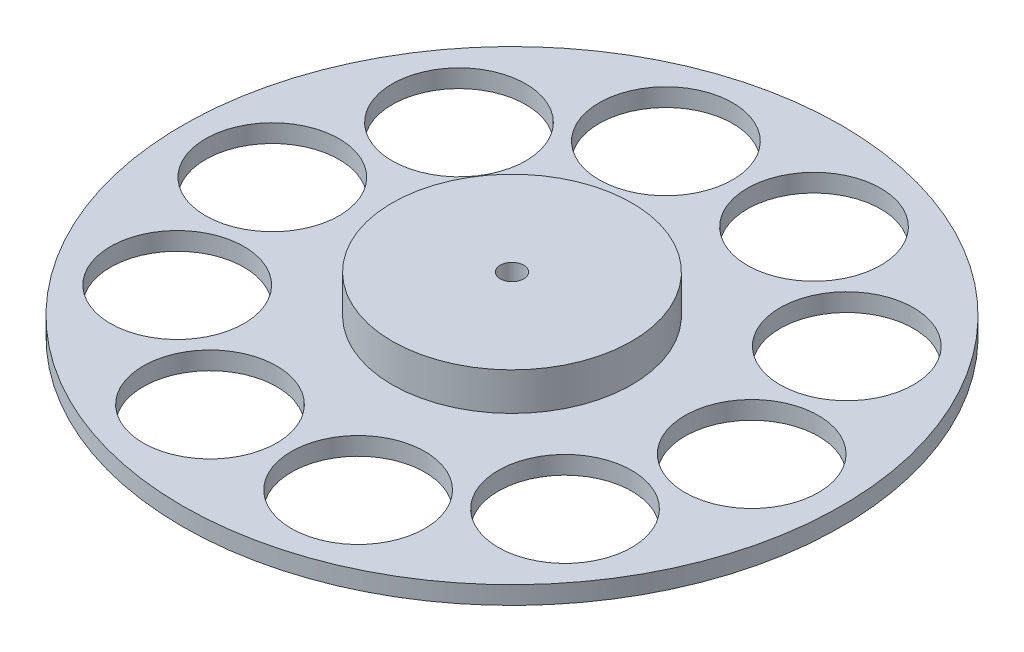
from build123d import *

# Parameters (mm, degrees)
SKETCH1_R                      = 69.85
BOSS_EXTRUDE1_DEPTH            = 3.81
SKETCH4_R                      = 25.4
BOSS_EXTRUDE5_DEPTH            = 7.99999997
SKETCH25_R                     = 11.43
CUT_EXTRUDE4_DEPTH             = 3.99999997
SKETCH5_R                      = 6
BOSS_EXTRUDE6_DEPTH            = 0.508
SKETCH26_R                     = 3.95
BOSS_EXTRUDE7_DEPTH            = 5
CUT_EXTRUDE1_DEPTH             = 100.486285986
CUT_EXTRUDE1_DEPTH_BACK        = 100.486285986
SKETCH6_R                      = 2.5
TAP_DRILL_FOR_M1_2X0_25_TAP1_D = 28.3


with BuildPart() as part:
    # Sketch1 → Boss-Extrude1 (new body)
    with BuildSketch(Plane(origin=(0, 0, 0), x_dir=(1, 0, 0), z_dir=(0, 1, 0))):
        Circle(SKETCH1_R)
    extrude(amount=BOSS_EXTRUDE1_DEPTH)

    # Sketch4 → Boss-Extrude5 (add)
    with BuildSketch(Plane(origin=(0, 3.81, 0), x_dir=(1, 0, 0), z_dir=(0, 1, 0))):
        Circle(SKETCH4_R)
    extrude(amount=BOSS_EXTRUDE5_DEPTH)

    # Sketch25 → Cut-Extrude4 (cut)
    with BuildSketch(Plane.XZ):
        Circle(SKETCH25_R)
    extrude(amount=-CUT_EXTRUDE4_DEPTH, mode=Mode.SUBTRACT)

    # Sketch5 → Boss-Extrude6 (add)
    with BuildSketch(Plane(origin=(0, 3.99999997, 0), x_dir=(1, 0, 0), z_dir=(0, 1, 0))):
        Circle(SKETCH5_R)
    extrude(amount=-BOSS_EXTRUDE6_DEPTH)

    # Sketch26 → Boss-Extrude7 (add)
    with BuildSketch(Plane.XZ.offset(-3.49199997)):
        Circle(SKETCH26_R)
    extrude(amount=BOSS_EXTRUDE7_DEPTH)

    # Sketch6 → Cut-Extrude1 (cut, two sides: drawn at the far end of the back side and taken through both)
    with BuildSketch(Plane.XZ.offset(-CUT_EXTRUDE1_DEPTH_BACK)):
        Circle(SKETCH6_R)
    extrude(amount=CUT_EXTRUDE1_DEPTH + CUT_EXTRUDE1_DEPTH_BACK, mode=Mode.SUBTRACT)

    # Tap Drill for M1.2x0.25 Tap1 (through all)
    with Locations(Plane(origin=(0, 3.81, 0), x_dir=(1, 0, 0), z_dir=(0, 1, 0))):
        with Locations((-50.8, 0), (-41.098063314, 29.859490816), (-15.698063314, 48.313671028), (15.698063314, 48.313671028), (41.098063314, 29.859490816), (50.8, 0), (41.098063314, -29.859490816), (15.698063314, -48.313671028), (-15.698063314, -48.313671028), (-41.098063314, -29.859490816)):
            Hole(TAP_DRILL_FOR_M1_2X0_25_TAP1_D / 2)


solid = part.part
